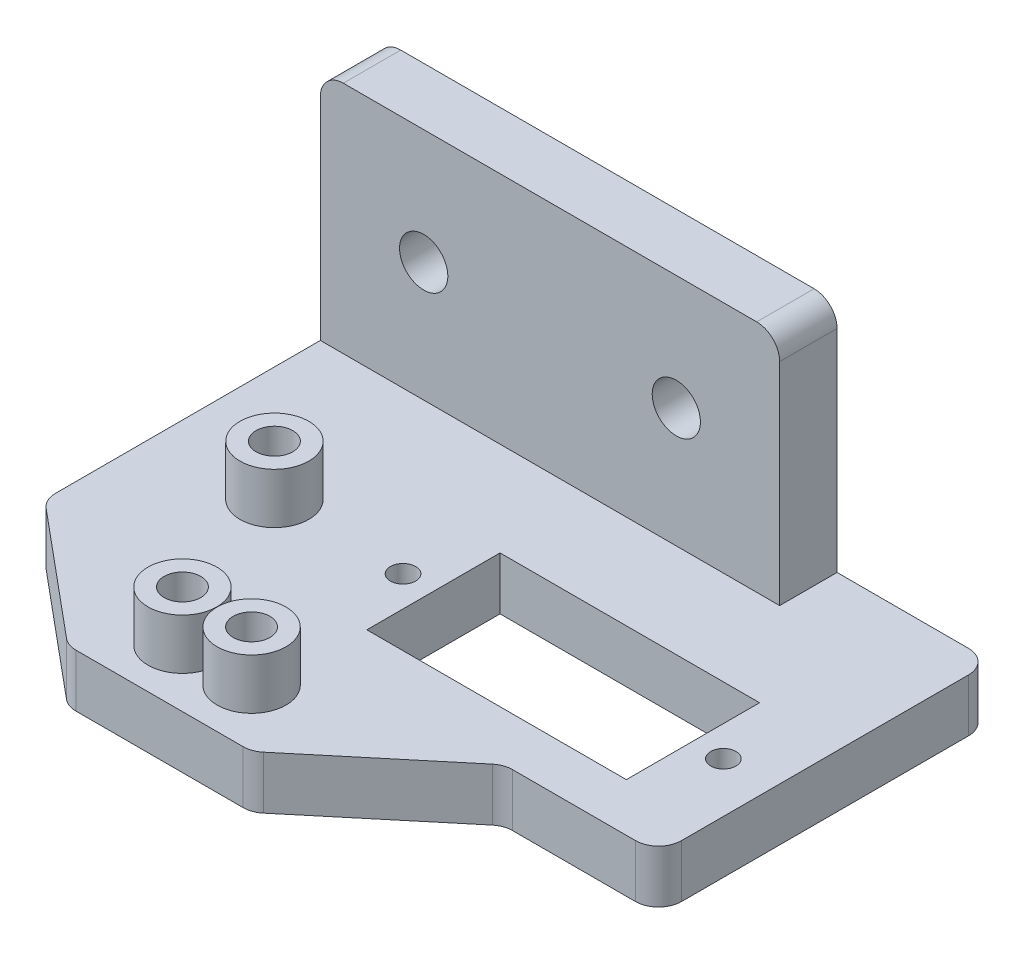
from build123d import *

# Parameters (mm, degrees)
SKETCH1_W           = 50
SKETCH1_H           = 35
BOSS_EXTRUDE1_DEPTH = 4.6
SKETCH2_W           = 22.6
SKETCH2_H           = 11.6
CUT_EXTRUDE1_DEPTH  = 62.20588207
SKETCH3_R           = 3
BOSS_EXTRUDE2_DEPTH = 4.4
SKETCH5_W           = 50
SKETCH5_H           = 2.5
BOSS_EXTRUDE3_DEPTH = 4.6
SKETCH6_R           = 1.6
CUT_EXTRUDE2_DEPTH  = 64.144675152
SKETCH7_W           = 50
SKETCH7_H           = 1.5
BOSS_EXTRUDE4_DEPTH = 4.6
SKETCH8_W           = 1.45
SKETCH8_H           = 39
BOSS_EXTRUDE5_DEPTH = 4.6
SKETCH9_W           = 40
SKETCH9_H           = 5
BOSS_EXTRUDE6_DEPTH = 20.4
SKETCH10_R          = 2.1
CUT_EXTRUDE3_DEPTH  = 69.161572752
SKETCH11_R          = 1.1
CUT_EXTRUDE4_DEPTH  = 66.745037836
SKETCH12_W          = 2
SKETCH12_H          = 39
BOSS_EXTRUDE7_DEPTH = 4.6
CUT_EXTRUDE5_DEPTH  = 68.278599867
FILLET1_R           = 2
FILLET2_R           = 2


with BuildPart() as part:
    # Sketch1 → Boss-Extrude1 (new body)
    with BuildSketch(Plane(origin=(0, 0, 0), x_dir=(1, 0, 0), z_dir=(0, 1, 0))):
        with Locations((25, -17.5)):
            Rectangle(SKETCH1_W, SKETCH1_H)
    extrude(amount=BOSS_EXTRUDE1_DEPTH)

    # Sketch2 → Cut-Extrude1 (cut, through all)
    with BuildSketch(Plane(origin=(0, 4.6, 0), x_dir=(1, 0, 0), z_dir=(0, 1, 0))):
        with Locations((33.7, -17.5)):
            Rectangle(SKETCH2_W, SKETCH2_H)
    extrude(amount=-CUT_EXTRUDE1_DEPTH, mode=Mode.SUBTRACT)

    # Sketch3 → Boss-Extrude2 (add)
    with BuildSketch(Plane(origin=(0, 4.6, 0), x_dir=(1, 0, 0), z_dir=(0, 1, 0))):
        with Locations(Location((8.55, -17.5, 0), (0, 0, 270))):
            Circle(SKETCH3_R)
        with Locations(Location((15.54, -32.5, 0), (0, 0, 303.557309762))):
            Circle(SKETCH3_R)
        with Locations(Location((21.56, -32.5, 0), (0, 0, 303.557309762))):
            Circle(SKETCH3_R)
    extrude(amount=BOSS_EXTRUDE2_DEPTH)

    # Sketch5 → Boss-Extrude3 (add)
    with BuildSketch(Plane(origin=(0, 4.6, 0), x_dir=(1, 0, 0), z_dir=(0, 1, 0))):
        with Locations((25, -36.25)):
            Rectangle(SKETCH5_W, SKETCH5_H)
    extrude(amount=-BOSS_EXTRUDE3_DEPTH)

    # Sketch6 → Cut-Extrude2 (cut, through all)
    with BuildSketch(Plane(origin=(0, 9, 0), x_dir=(1, 0, 0), z_dir=(0, 1, 0))):
        with Locations(Location((8.55, -17.5, 0), (0, 0, 270))):
            Circle(SKETCH6_R)
        with Locations(Location((15.54, -32.5, 0), (0, 0, 270))):
            Circle(SKETCH6_R)
        with Locations(Location((21.56, -32.5, 0), (0, 0, 270))):
            Circle(SKETCH6_R)
    extrude(amount=-CUT_EXTRUDE2_DEPTH, mode=Mode.SUBTRACT)

    # Sketch7 → Boss-Extrude4 (add)
    with BuildSketch(Plane(origin=(0, 4.6, 0), x_dir=(1, 0, 0), z_dir=(0, 1, 0))):
        with Locations((25, 0.75)):
            Rectangle(SKETCH7_W, SKETCH7_H)
    extrude(amount=-BOSS_EXTRUDE4_DEPTH)

    # Sketch8 → Boss-Extrude5 (add)
    with BuildSketch(Plane(origin=(0, 4.6, 0), x_dir=(1, 0, 0), z_dir=(0, 1, 0))):
        with Locations((-0.725, -18)):
            Rectangle(SKETCH8_W, SKETCH8_H)
    extrude(amount=-BOSS_EXTRUDE5_DEPTH)

    # Sketch9 → Boss-Extrude6 (add)
    with BuildSketch(Plane(origin=(0, 4.6, 0), x_dir=(1, 0, 0), z_dir=(0, 1, 0))):
        with Locations((18.55, -1)):
            Rectangle(SKETCH9_W, SKETCH9_H)
    extrude(amount=BOSS_EXTRUDE6_DEPTH)

    # Sketch10 → Cut-Extrude3 (cut, through all)
    with BuildSketch(Plane(origin=(0, 0, -1.5), x_dir=(-1, 0, 0), z_dir=(0, 0, -1))):
        with Locations((-29.55, 15)):
            Circle(SKETCH10_R)
        with Locations((-7.55, 15)):
            Circle(SKETCH10_R)
    extrude(amount=-CUT_EXTRUDE3_DEPTH, mode=Mode.SUBTRACT)

    # Sketch11 → Cut-Extrude4 (cut, through all)
    with BuildSketch(Plane(origin=(0, 4.6, 0), x_dir=(1, 0, 0), z_dir=(0, 1, 0))):
        with Locations(Location((47.65, -17.5, 0), (0, 0, 270))):
            Circle(SKETCH11_R)
        with Locations(Location((19.75, -17.5, 0), (0, 0, 270))):
            Circle(SKETCH11_R)
    extrude(amount=-CUT_EXTRUDE4_DEPTH, mode=Mode.SUBTRACT)

    # Sketch12 → Boss-Extrude7 (add)
    with BuildSketch(Plane(origin=(0, 4.6, 0), x_dir=(1, 0, 0), z_dir=(0, 1, 0))):
        with Locations((51, -18)):
            Rectangle(SKETCH12_W, SKETCH12_H)
    extrude(amount=-BOSS_EXTRUDE7_DEPTH)

    # Sketch13 → Cut-Extrude5 (cut, through all)
    with BuildSketch(Plane(origin=(0, 4.6, 0), x_dir=(1, 0, 0), z_dir=(0, 1, 0))):
        Polygon((10.54, -37.5), (-1.45, -27.5), (-1.45, -37.5), align=None)
        Polygon((26.56, -37.5), (38.549602016, -27.5), (52, -27.5), (52, -37.5), align=None)
    extrude(amount=-CUT_EXTRUDE5_DEPTH, mode=Mode.SUBTRACT)

    # Fillet1
    fillet1_edges = [part.edges().sort_by_distance(p)[0] for p in [
        (52, 2.3, -1.5),
        (10.54, 2.3, 37.5),
        (-1.45, 2.3, 27.5),
        (26.56, 2.3, 37.5),
        (38.549602016, 2.3, 27.5),
        (52, 2.3, 27.5),
    ]]
    fillet(fillet1_edges, radius=FILLET1_R)

    # Fillet2
    fillet2_edges = [part.edges().sort_by_distance(p)[0] for p in [
        (-1.45, 25, 1),
        (38.55, 25, 1),
    ]]
    fillet(fillet2_edges, radius=FILLET2_R)


solid = part.part
